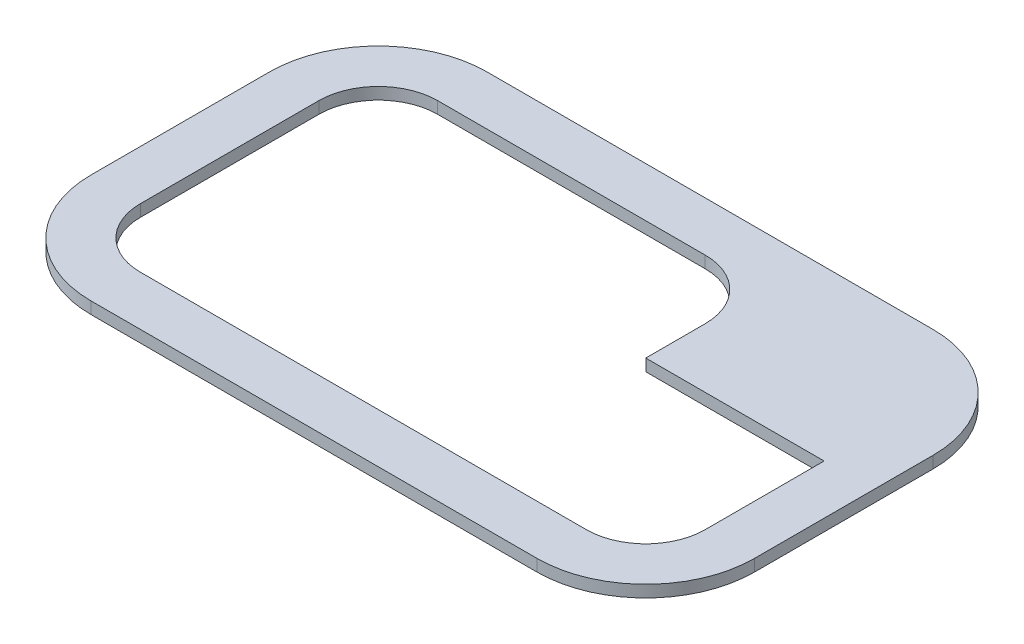
from build123d import *

# Parameters (mm, degrees)
BOSS_EXTRUDE1_DEPTH = 6


with BuildPart() as part:
    # Sketch1 → Boss-Extrude1 (new body)
    with BuildSketch(Plane(origin=(0, 0, 0), x_dir=(1, 0, 0), z_dir=(0, 1, 0))):
        with BuildLine():
            Line((0, -55), (225, -55))
            ThreePointArc((225, -55), (263.890872965, -38.890872965), (280, 0))
            Line((280, 0), (280, 90))
            ThreePointArc((280, 90), (263.890872965, 128.890872965), (225, 145))
            Line((225, 145), (0, 145))
            ThreePointArc((0, 145), (-38.890872965, 128.890872965), (-55, 90))
            Line((-55, 90), (-55, 0))
            ThreePointArc((-55, 0), (-38.890872965, -38.890872965), (0, -55))
        make_face()
        with BuildLine():
            Line((0, -30), (225, -30))
            ThreePointArc((225, -30), (246.213203436, -21.213203436), (255, 0))
            Line((255, 0), (255, 60))
            Line((255, 60), (165, 60))
            Line((165, 60), (165, 90))
            ThreePointArc((165, 90), (156.213203436, 111.213203436), (135, 120))
            Line((135, 120), (0, 120))
            ThreePointArc((0, 120), (-21.213203436, 111.213203436), (-30, 90))
            Line((-30, 90), (-30, 0))
            ThreePointArc((-30, 0), (-21.213203436, -21.213203436), (0, -30))
        make_face(mode=Mode.SUBTRACT)
    extrude(amount=BOSS_EXTRUDE1_DEPTH)


solid = part.part
